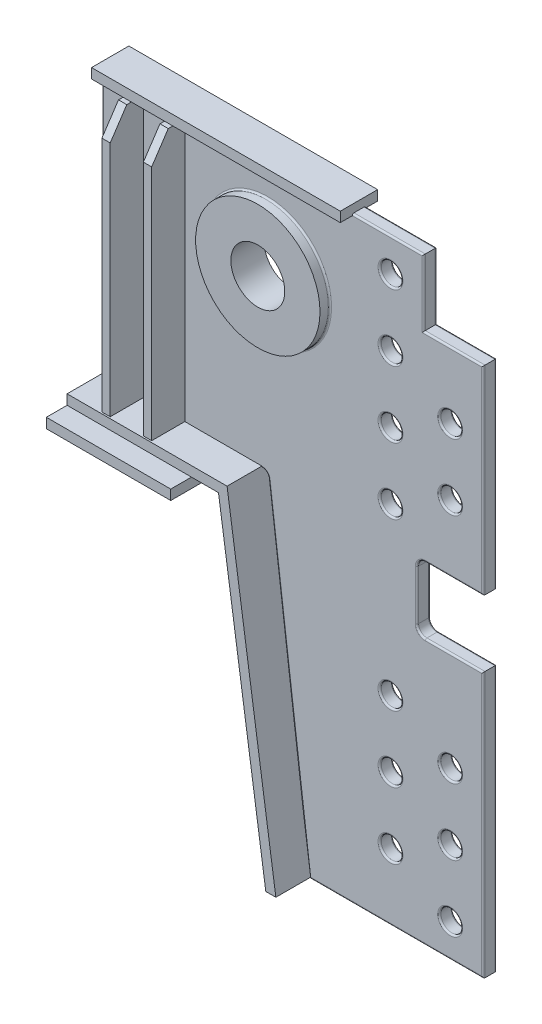
from build123d import *

# Parameters (mm, degrees)
SKETCH_1_R           = 13
SKETCH_1_R_2         = 37.5
EXTRUDE_1319_DEPTH   = 16
EXTRUDE_1_DEPTH      = 12
EXTRUDE_1_DEPTH_BACK = 28
SKETCH_2_R           = 75
SKETCH_2_R_2         = 32.5
FILLET_1_R           = 2
FILLET_2_R           = 2
EXTRUDE_2_DEPTH      = 40
EXTRUDE_2_DEPTH_BACK = 56
SKETCH_3_W           = 10
SKETCH_3_H           = 316
CUT_EXTRUDE_1_DEPTH  = 836.425640018
CUT_EXTRUDE_2_DEPTH  = 836.425640018
EXTRUDE_5_DEPTH      = 42
EXTRUDE_5_DEPTH_BACK = 58
EXTRUDE_6_DEPTH      = 14.5
EXTRUDE_6_DEPTH_BACK = 30.5
SKETCH_7_W           = 300
SKETCH_7_H           = 12
SKETCH_8_W           = 150
SKETCH_8_H           = 150
EXTRUDE_7_DEPTH      = 12


with BuildPart() as part:
    # 草图1 → Extrude 1319 (new body)
    with BuildSketch(Plane.XY):
        with BuildLine():
            Line((0, -320), (-70, -320))
            ThreePointArc((-70, -320), (-77.071067812, -322.928932188), (-80, -330))
            Line((-80, -330), (-80, -390))
            ThreePointArc((-80, -390), (-77.071067812, -397.071067812), (-70, -400))
            Line((-70, -400), (0, -400))
            Line((0, -400), (0, -720))
            Line((0, -720), (-210, -720))
            Line((-210, -720), (-259.124034735, -327.007722123))
            ThreePointArc((-259.124034735, -327.007722123), (-261.767837242, -322.002574593), (-267.062257748, -320))
            Line((-267.062257748, -320), (-460, -320))
            Line((-460, -320), (-460, 0))
            Line((-460, 0), (-72, 0))
            Line((-72, 0), (-72, -80))
            Line((-72, -80), (0, -80))
            Line((0, -80), (0, -320))
        make_face()
        with Locations((-112, -40)):
            Circle(SKETCH_1_R, mode=Mode.SUBTRACT)
        with Locations((-112, -120)):
            Circle(SKETCH_1_R, mode=Mode.SUBTRACT)
        with Locations((-112, -200)):
            Circle(SKETCH_1_R, mode=Mode.SUBTRACT)
        with Locations((-112, -280)):
            Circle(SKETCH_1_R, mode=Mode.SUBTRACT)
        with Locations((-40, -160)):
            Circle(SKETCH_1_R, mode=Mode.SUBTRACT)
        with Locations((-40, -240)):
            Circle(SKETCH_1_R, mode=Mode.SUBTRACT)
        with Locations((-40, -680)):
            Circle(SKETCH_1_R, mode=Mode.SUBTRACT)
        with Locations((-40, -600)):
            Circle(SKETCH_1_R, mode=Mode.SUBTRACT)
        with Locations((-40, -520)):
            Circle(SKETCH_1_R, mode=Mode.SUBTRACT)
        with Locations((-112, -640)):
            Circle(SKETCH_1_R, mode=Mode.SUBTRACT)
        with Locations((-112, -560)):
            Circle(SKETCH_1_R, mode=Mode.SUBTRACT)
        with Locations((-112, -480)):
            Circle(SKETCH_1_R, mode=Mode.SUBTRACT)
        with Locations((-260, -110)):
            Circle(SKETCH_1_R_2, mode=Mode.SUBTRACT)
    extrude(amount=EXTRUDE_1319_DEPTH)

    # 草图2 → 凸台-拉伸1 (add, two sides: drawn at the far end of the back side and taken through both)
    with BuildSketch(Plane.XY.offset(16).offset(-EXTRUDE_1_DEPTH_BACK)):
        with Locations((-260, -110)):
            Circle(SKETCH_2_R)
        with Locations((-260, -110)):
            Circle(SKETCH_2_R_2, mode=Mode.SUBTRACT)
    extrude(amount=EXTRUDE_1_DEPTH + EXTRUDE_1_DEPTH_BACK)

    # 圆角1
    fillet_1_edges = [part.edges().sort_by_distance(p)[0] for p in [
        (-105, -720, 16),
        (0, -560, 16),
        (-35, -400, 16),
        (-77.071067812, -397.071067812, 16),
        (-80, -360, 16),
        (-77.071067812, -322.928932188, 16),
        (-35, -320, 16),
        (0, -200, 16),
        (-36, -80, 16),
        (-125, -40, 16),
        (-72, -40, 16),
        (-261.767837242, -322.002574593, 16),
        (-266, 0, 16),
        (-125, -120, 16),
        (-460, -160, 16),
        (-125, -200, 16),
        (-363.531128874, -320, 16),
        (-125, -280, 16),
        (-53, -160, 16),
        (-53, -240, 16),
        (-53, -680, 16),
        (-53, -600, 16),
        (-53, -520, 16),
        (-234.562017367, -523.503861062, 16),
        (-125, -640, 16),
        (-125, -560, 16),
        (-125, -480, 16),
        (-335, -110, 16),
    ]]
    fillet(fillet_1_edges, radius=FILLET_1_R)

    # 圆角2
    fillet_2_edges = [part.edges().sort_by_distance(p)[0] for p in [
        (-363.531128874, -320, 0),
        (-460, -160, 0),
        (-266, 0, 0),
        (-72, -40, 0),
        (-36, -80, 0),
        (0, -200, 0),
        (-35, -320, 0),
        (-77.071067812, -322.928932188, 0),
        (-80, -360, 0),
        (-77.071067812, -397.071067812, 0),
        (-35, -400, 0),
        (0, -560, 0),
        (-105, -720, 0),
        (-234.562017367, -523.503861062, 0),
        (-261.767837242, -322.002574593, 0),
        (-125, -40, 0),
        (-125, -120, 0),
        (-125, -200, 0),
        (-125, -280, 0),
        (-53, -160, 0),
        (-53, -240, 0),
        (-53, -680, 0),
        (-53, -600, 0),
        (-53, -520, 0),
        (-125, -640, 0),
        (-125, -560, 0),
        (-125, -480, 0),
        (-335, -110, 0),
    ]]
    fillet(fillet_2_edges, radius=FILLET_2_R)

    # 草图3 → 凸台-拉伸2 (add, two sides: drawn at the far end of the back side and taken through both)
    with BuildSketch(Plane.XY.offset(16).offset(-EXTRUDE_2_DEPTH_BACK)):
        with Locations((-415, -160)):
            Rectangle(SKETCH_3_W, SKETCH_3_H)
        with Locations((-365, -160)):
            Rectangle(SKETCH_3_W, SKETCH_3_H)
    extrude(amount=EXTRUDE_2_DEPTH + EXTRUDE_2_DEPTH_BACK)

    # 草图4 → 切除-拉伸1 (cut, through all)
    with BuildSketch(Plane.ZY.offset(420)):
        Polygon((-20, -2), (-45.5, -32), (-45.5, -2), align=None)
    extrude(amount=-CUT_EXTRUDE_1_DEPTH, mode=Mode.SUBTRACT)

    # 草图5 → 切除-拉伸2 (cut, through all)
    with BuildSketch(Plane.ZY.offset(420)):
        Polygon((36, -2), (56, -32), (56, -2), align=None)
    extrude(amount=-CUT_EXTRUDE_2_DEPTH, mode=Mode.SUBTRACT)

    # 草图6 → 凸台-拉伸5 (add, two sides: drawn at the far end of the back side and taken through both)
    with BuildSketch(Plane.XY.offset(16).offset(-EXTRUDE_5_DEPTH_BACK)):
        Polygon((-267.062257748, -318), (-460, -318), (-460, -330), (-277.426505546, -330), (-220.363518026, -718), (-208.234435563, -718), align=None)
    extrude(amount=EXTRUDE_5_DEPTH + EXTRUDE_5_DEPTH_BACK)

    # 草图7 → 凸台-拉伸6 (add, two sides: drawn at the far end of the back side and taken through both)
    with BuildSketch(Plane(origin=(0, 0, 0), x_dir=(-1, 0, 0), z_dir=(0, 0, -1)).offset(-EXTRUDE_6_DEPTH_BACK)):
        with Locations((308, 4)):
            Rectangle(SKETCH_7_W, SKETCH_7_H)
    extrude(amount=EXTRUDE_6_DEPTH + EXTRUDE_6_DEPTH_BACK)

    # 草图8 → 凸台-拉伸7 (add)
    with BuildSketch(Plane.XZ.offset(330)):
        with Locations((-385, 8)):
            Rectangle(SKETCH_8_W, SKETCH_8_H)
    extrude(amount=EXTRUDE_7_DEPTH)


solid = part.part
